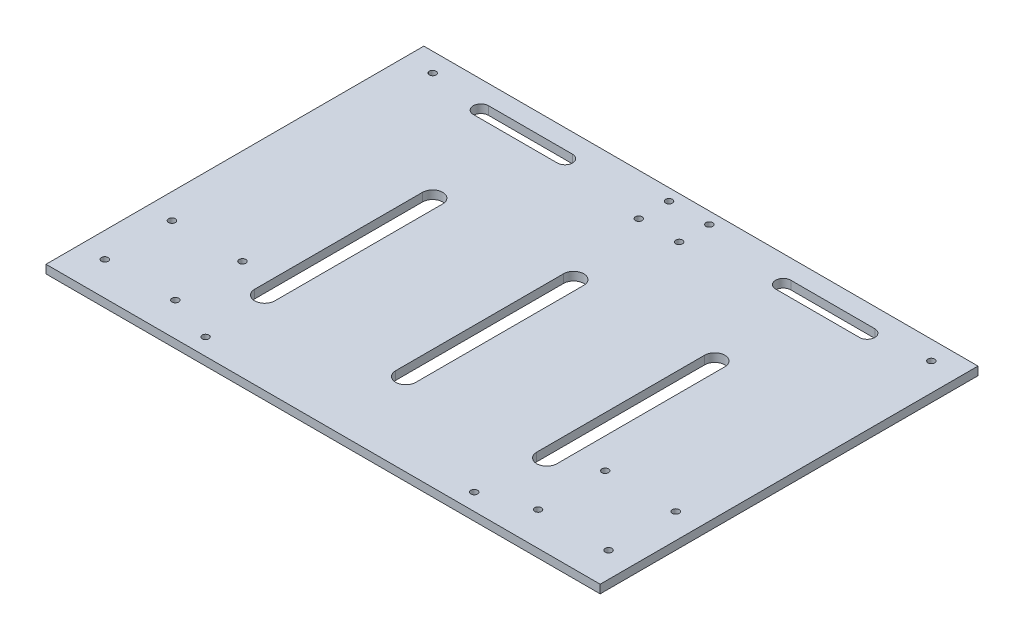
from build123d import *

# Parameters (mm, degrees)
SKETCH_1_W          = 330
SKETCH_1_H          = 225
EXTRUDE_1_DEPTH     = 5
SKETCH_2_R          = 2
CUT_EXTRUDE_1_DEPTH = 395.101001153
SKETCH_3_R          = 2
CUT_EXTRUDE_2_DEPTH = 395.101001153
CUT_EXTRUDE_4_DEPTH = 395.101001153
SKETCH_6_R          = 2
CUT_EXTRUDE_5_DEPTH = 395.101001153


with BuildPart() as part:
    # 草图1 → 凸台-拉伸1 (new body)
    with BuildSketch(Plane(origin=(0, 0, 0), x_dir=(1, 0, 0), z_dir=(0, 1, 0))):
        with Locations((149.701456311, 124.678398058)):
            Rectangle(SKETCH_1_W, SKETCH_1_H)
    extrude(amount=EXTRUDE_1_DEPTH)

    # 草图2 → 切除-拉伸1 (cut, through all)
    with BuildSketch(Plane(origin=(0, 5, 0), x_dir=(1, 0, 0), z_dir=(0, 1, 0))):
        with Locations(Location((137.701456311, 230.178398058, 0), (0, 0, 270))):
            Circle(SKETCH_2_R)
        with Locations(Location((161.701456311, 230.178398058, 0), (0, 0, 90))):
            Circle(SKETCH_2_R)
        with Locations(Location((137.701456311, 212.178398058, 0), (0, 0, 270))):
            Circle(SKETCH_2_R)
        with Locations(Location((161.701456311, 212.178398058, 0), (0, 0, 90))):
            Circle(SKETCH_2_R)
        with BuildLine():
            Line((34.701456311, 225.715369926), (84.701456311, 225.715369926))
            ThreePointArc((84.701456311, 225.715369926), (89.238428179, 221.178398058), (84.701456311, 216.64142619))
            Line((84.701456311, 216.64142619), (34.701456311, 216.64142619))
            ThreePointArc((34.701456311, 216.64142619), (30.164484443, 221.178398058), (34.701456311, 225.715369926))
        make_face()
        with BuildLine():
            Line((264.701456311, 225.715369926), (214.701456311, 225.715369926))
            ThreePointArc((214.701456311, 225.715369926), (210.164484443, 221.178398058), (214.701456311, 216.64142619))
            Line((214.701456311, 216.64142619), (264.701456311, 216.64142619))
            ThreePointArc((264.701456311, 216.64142619), (269.238428179, 221.178398058), (264.701456311, 225.715369926))
        make_face()
    extrude(amount=-CUT_EXTRUDE_1_DEPTH, mode=Mode.SUBTRACT)

    # 草图3 → 切除-拉伸2 (cut, through all)
    with BuildSketch(Plane(origin=(0, 5, 0), x_dir=(1, 0, 0), z_dir=(0, 1, 0))):
        with Locations(Location((-0.298543689, 32.178398058, 0), (0, 0, 270))):
            Circle(SKETCH_3_R)
        with Locations(Location((-0.298543689, 72.178398058, 0), (0, 0, 90))):
            Circle(SKETCH_3_R)
        with Locations(Location((41.701456311, 32.178398058, 0), (0, 0, 270))):
            Circle(SKETCH_3_R)
        with Locations(Location((41.701456311, 72.178398058, 0), (0, 0, 90))):
            Circle(SKETCH_3_R)
        with Locations(Location((257.701456311, 72.178398058, 0), (0, 0, 270))):
            Circle(SKETCH_3_R)
        with Locations(Location((257.701456311, 32.178398058, 0), (0, 0, 90))):
            Circle(SKETCH_3_R)
        with Locations(Location((299.701456311, 72.178398058, 0), (0, 0, 270))):
            Circle(SKETCH_3_R)
        with Locations(Location((299.701456311, 32.178398058, 0), (0, 0, 90))):
            Circle(SKETCH_3_R)
    extrude(amount=-CUT_EXTRUDE_2_DEPTH, mode=Mode.SUBTRACT)

    # 草图5 → 切除-拉伸4 (cut, through all)
    with BuildSketch(Plane(origin=(0, 5, 0), x_dir=(1, 0, 0), z_dir=(0, 1, 0))):
        with BuildLine():
            Line((155.701456311, 161.411602286), (155.701456311, 61.411602286))
            ThreePointArc((155.701456311, 61.411602286), (149.701456311, 55.411602286), (143.701456311, 61.411602286))
            Line((143.701456311, 61.411602286), (143.701456311, 161.411602286))
            ThreePointArc((143.701456311, 161.411602286), (149.701456311, 167.411602286), (155.701456311, 161.411602286))
        make_face()
        with BuildLine():
            Line((239.701456311, 161.411602286), (239.701456311, 61.411602286))
            ThreePointArc((239.701456311, 61.411602286), (233.701456311, 55.411602286), (227.701456311, 61.411602286))
            Line((227.701456311, 61.411602286), (227.701456311, 161.411602286))
            ThreePointArc((227.701456311, 161.411602286), (233.701456311, 167.411602286), (239.701456311, 161.411602286))
        make_face()
        with BuildLine():
            Line((59.701456311, 161.411602286), (59.701456311, 61.411602286))
            ThreePointArc((59.701456311, 61.411602286), (65.701456311, 55.411602286), (71.701456311, 61.411602286))
            Line((71.701456311, 61.411602286), (71.701456311, 161.411602286))
            ThreePointArc((71.701456311, 161.411602286), (65.701456311, 167.411602286), (59.701456311, 161.411602286))
        make_face()
    extrude(amount=-CUT_EXTRUDE_4_DEPTH, mode=Mode.SUBTRACT)

    # 草图6 → 切除-拉伸5 (cut, through all)
    with BuildSketch(Plane(origin=(0, 5, 0), x_dir=(1, 0, 0), z_dir=(0, 1, 0))):
        with Locations(Location((1.226003167, 225.911661565, 0), (0, 0, 270))):
            Circle(SKETCH_6_R)
        with Locations(Location((298.176909455, 225.911661565, 0), (0, 0, 90))):
            Circle(SKETCH_6_R)
        with Locations(Location((69.701456311, 22.178398058, 0), (0, 0, 270))):
            Circle(SKETCH_6_R)
        with Locations(Location((229.701456311, 22.178398058, 0), (0, 0, 90))):
            Circle(SKETCH_6_R)
    extrude(amount=-CUT_EXTRUDE_5_DEPTH, mode=Mode.SUBTRACT)


solid = part.part
